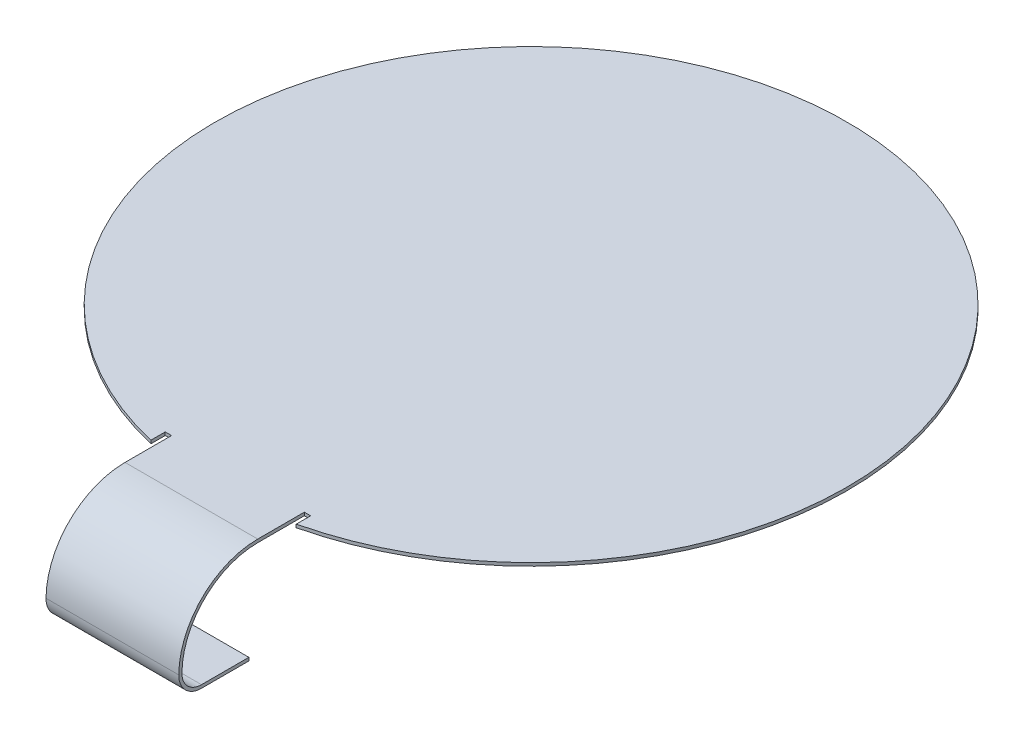
from build123d import *

# Parameters (mm, degrees)
SKETCH1_R                       = 10
BOSS_EXTRUDE1_DEPTH             = 0.1
BOSS_EXTRUDE2_START             = -2
SKETCH3_W                       = 4.2
SKETCH3_H                       = 1
BOSS_EXTRUDE2_DEPTH             = 0.1
EXTRUDE_THIN1_REACH             = 17.393
EXTRUDE_THIN1_DIRECTION_2_REACH = 17.393
SKETCH5_W                       = 0.2
SKETCH5_H                       = 0.5
CUT_EXTRUDE1_DEPTH              = 0.1


with BuildPart() as part:
    # Sketch1 → Boss-Extrude1 (new body)
    with BuildSketch(Plane(origin=(0, 1.1, 0), x_dir=(1, 0, 0), z_dir=(0, 1, 0))):
        with Locations(Location((0, 1.53064501, 0), (0, 0, 270))):
            Circle(SKETCH1_R)
    extrude(amount=BOSS_EXTRUDE1_DEPTH)


with BuildPart() as body_2:
    # Sketch3 → Boss-Extrude2 (new body)
    with BuildSketch(Plane(origin=(0, 0, 0), x_dir=(1, 0, 0), z_dir=(0, 1, 0)).offset(BOSS_EXTRUDE2_START)):
        with Locations((0, -10)):
            Rectangle(SKETCH3_W, SKETCH3_H)
    extrude(amount=BOSS_EXTRUDE2_DEPTH)

    # Extrude-Thin1: up to this face of the body (flat: up to its plane)
    extrude_thin1_end = Plane(body_2.part.faces().sort_by_distance((2.1, -1.95, 10))[0])
    # Sketch4 → Extrude-Thin1 (add, up to the picked face)
    with BuildSketch(Plane(origin=(0, 0, 0), x_dir=(0, 0, -1), z_dir=(1, 0, 0)), mode=Mode.PRIVATE) as extrude_thin1_sk1:
        with BuildLine():
            Line((-9.5, -2), (-10.5, -2))
            Line((-10.5, -2), (-11, -2))
            ThreePointArc((-11, -2), (-11.511328882, -1.786579748), (-11.7192089, -1.27297355))
            ThreePointArc((-11.7192089, -1.27297355), (-10.977540685, 0.47729656), (-9.21935499, 1.2))
            Line((-9.21935499, 1.2), (-8.46935499, 1.2))
            Line((-8.46935499, 1.2), (-5, 1.2))
            Line((-5, 1.2), (-5, 1.1))
            Line((-5, 1.1), (-8.46935499, 1.1))
            Line((-8.46935499, 1.1), (-9.21935499, 1.1))
            ThreePointArc((-9.21935499, 1.1), (-10.907213257, 0.406204698), (-11.619214744, -1.274054608))
            ThreePointArc((-11.619214744, -1.274054608), (-11.440237019, -1.716252321), (-11, -1.9))
            Line((-11, -1.9), (-10.5, -1.9))
            Line((-10.5, -1.9), (-9.5, -1.9))
            Line((-9.5, -1.9), (-9.5, -2))
        make_face()
    extrude_thin1_tool1 = split(extrude(extrude_thin1_sk1.sketch, amount=EXTRUDE_THIN1_REACH, mode=Mode.PRIVATE), bisect_by=extrude_thin1_end, keep=Keep.BOTH, mode=Mode.PRIVATE)

    add(part.part)  # Extrude-Thin1 merges part
    add(extrude_thin1_tool1.solids().sort_by(Axis((0, -1.974423, 10.75), (1, 0, 0)))[0])

    # Extrude-Thin1 direction 2: up to this face of the body (flat: up to its plane)
    extrude_thin1_direction_2_end = Plane(body_2.part.faces().sort_by_distance((-2.1, -1.95, 10))[0])
    # Sketch4 → Extrude-Thin1 direction 2 (add, up to the picked face)
    with BuildSketch(Plane(origin=(0, 0, 0), x_dir=(0, 0, -1), z_dir=(1, 0, 0)), mode=Mode.PRIVATE) as extrude_thin1_direction_2_sk1:
        with BuildLine():
            Line((-9.5, -2), (-10.5, -2))
            Line((-10.5, -2), (-11, -2))
            ThreePointArc((-11, -2), (-11.511328882, -1.786579748), (-11.7192089, -1.27297355))
            ThreePointArc((-11.7192089, -1.27297355), (-10.977540685, 0.47729656), (-9.21935499, 1.2))
            Line((-9.21935499, 1.2), (-8.46935499, 1.2))
            Line((-8.46935499, 1.2), (-5, 1.2))
            Line((-5, 1.2), (-5, 1.1))
            Line((-5, 1.1), (-8.46935499, 1.1))
            Line((-8.46935499, 1.1), (-9.21935499, 1.1))
            ThreePointArc((-9.21935499, 1.1), (-10.907213257, 0.406204698), (-11.619214744, -1.274054608))
            ThreePointArc((-11.619214744, -1.274054608), (-11.440237019, -1.716252321), (-11, -1.9))
            Line((-11, -1.9), (-10.5, -1.9))
            Line((-10.5, -1.9), (-9.5, -1.9))
            Line((-9.5, -1.9), (-9.5, -2))
        make_face()
    extrude_thin1_direction_2_tool1 = split(extrude(extrude_thin1_direction_2_sk1.sketch, amount=-EXTRUDE_THIN1_DIRECTION_2_REACH, mode=Mode.PRIVATE), bisect_by=extrude_thin1_direction_2_end, keep=Keep.BOTH, mode=Mode.PRIVATE)
    add(extrude_thin1_direction_2_tool1.solids().sort_by(Axis((0, -1.974423, 10.75), (-1, 0, 0)))[0])

    # Sketch5 → Cut-Extrude1 (cut)
    with BuildSketch(Plane(origin=(0, 1.2, 0), x_dir=(1, 0, 0), z_dir=(0, 1, 0))):
        with Locations((-2.2, -7.996368849)):
            Rectangle(SKETCH5_W, SKETCH5_H)
        with Locations((2.2, -7.996368849)):
            Rectangle(SKETCH5_W, SKETCH5_H)
    extrude(amount=-CUT_EXTRUDE1_DEPTH, mode=Mode.SUBTRACT)


solid = body_2.part
